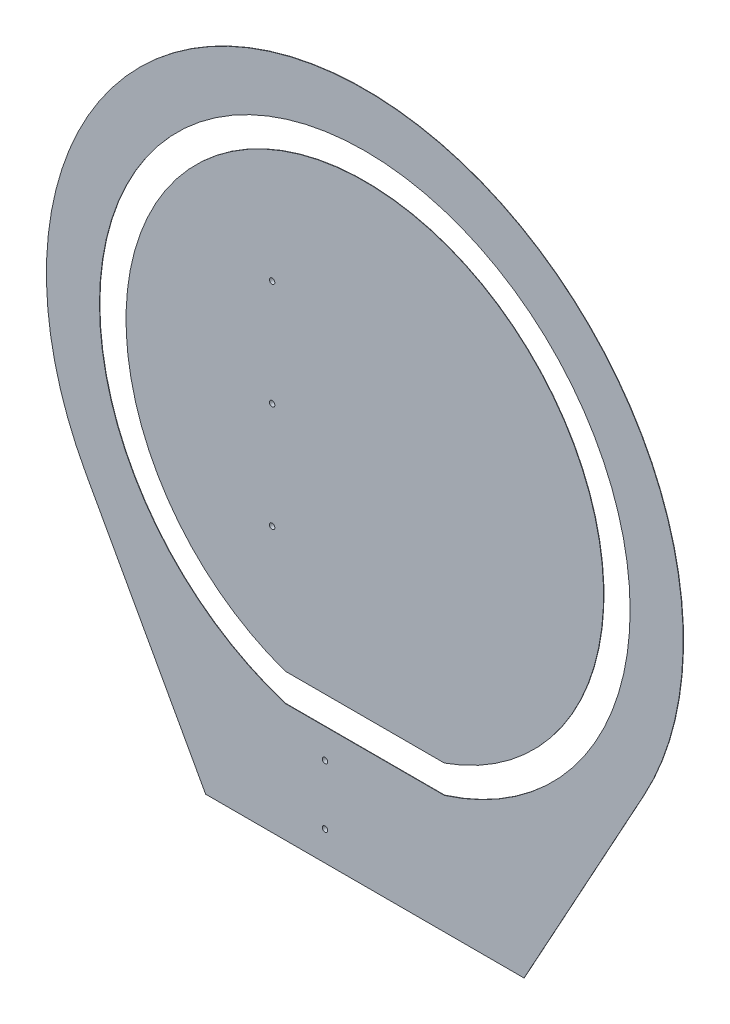
from build123d import *
from build123d.topology import SkipClean

# Parameters (mm, degrees)
BOSS_EXTRUDE1_DEPTH      = 0.03556
BOSS_EXTRUDE1_2_DEPTH    = 0.03556
SKETCH2_R                = 0.254
CUT_EXTRUDE1_DEPTH       = 10
ESBO_O1_R                = 0.27178
ESBO_O1_R_2              = 0.254
RESSALTO_EXTRUS_O1_DEPTH = 0.75438


with BuildPart() as part:
    # Sketch1 → Boss-Extrude1 (new body)
    with BuildSketch(Plane.XY):
        with BuildLine():
            Line((-7.500000004, -21.213203434), (7.500000004, -21.213203434))
            ThreePointArc((7.500000004, -21.213203434), (0, 22.5), (-7.500000004, -21.213203434))
        make_face()
    extrude(amount=BOSS_EXTRUDE1_DEPTH)


with BuildPart() as body_2:
    # Sketch1 → Boss-Extrude1 2 (new body)
    with BuildSketch(Plane.XY):
        with BuildLine():
            Line((-15, -35.000000034), (15, -35.000000034))
            Line((15, -35.000000034), (26.292884658, -14.445906561))
            ThreePointArc((26.292884658, -14.445906561), (0, 30), (-26.292884658, -14.445906561))
            Line((-26.292884658, -14.445906561), (-15, -35.000000034))
        make_face()
        with BuildLine():
            Line((-7.500000004, -23.848480034), (7.500000004, -23.848480034))
            ThreePointArc((7.500000004, -23.848480034), (0, 25), (-7.500000004, -23.848480034))
        make_face(mode=Mode.SUBTRACT)
    extrude(amount=BOSS_EXTRUDE1_2_DEPTH)


with BuildPart() as cut_extrude1_tool:
    # Sketch2 → Cut-Extrude1 (new body)
    with BuildSketch(Plane.XY.offset(0.03556)):
        with BuildLine():
            ThreePointArc((-3.496000002, -32.224240034), (-3.57039488, -32.044634912), (-3.750000002, -31.970240034))
            Line((-3.750000002, -31.970240034), (-3.750000002, -32.478240034))
            ThreePointArc((-3.750000002, -32.478240034), (-3.57039488, -32.403845156), (-3.496000002, -32.224240034))
        make_face()
        with BuildLine():
            Line((-3.750000002, -32.478240034), (-3.750000002, -31.970240034))
            ThreePointArc((-3.750000002, -31.970240034), (-4.004000002, -32.224240034), (-3.750000002, -32.478240034))
        make_face()
        with BuildLine():
            ThreePointArc((-3.496000002, -26.624240034), (-3.57039488, -26.444634912), (-3.750000002, -26.370240034))
            Line((-3.750000002, -26.370240034), (-3.750000002, -26.878240034))
            ThreePointArc((-3.750000002, -26.878240034), (-3.57039488, -26.803845156), (-3.496000002, -26.624240034))
        make_face()
        with BuildLine():
            Line((-3.750000002, -26.878240034), (-3.750000002, -26.370240034))
            ThreePointArc((-3.750000002, -26.370240034), (-4.004000002, -26.624240034), (-3.750000002, -26.878240034))
        make_face()
        with BuildLine():
            ThreePointArc((-8.479792148, -10), (-8.554187026, -9.820394878), (-8.733792148, -9.746))
            Line((-8.733792148, -9.746), (-8.733792148, -10.254))
            ThreePointArc((-8.733792148, -10.254), (-8.554187026, -10.179605122), (-8.479792148, -10))
        make_face()
        with BuildLine():
            Line((-8.733792148, -10.254), (-8.733792148, -9.746))
            ThreePointArc((-8.733792148, -9.746), (-8.987792148, -10), (-8.733792148, -10.254))
        make_face()
        with Locations((-8.733792148, 0)):
            Circle(SKETCH2_R)
        with Locations((-8.733792148, 10)):
            Circle(SKETCH2_R)
    extrude(amount=-CUT_EXTRUDE1_DEPTH)


with BuildPart() as part_1:
    add(part.part)

    # Cut-Extrude1: cut by cut_extrude1_tool
    add(cut_extrude1_tool.part, mode=Mode.SUBTRACT)



with BuildPart() as body_2_1:
    add(body_2.part)

    # Cut-Extrude1: cut by cut_extrude1_tool
    add(cut_extrude1_tool.part, mode=Mode.SUBTRACT)


with BuildPart() as part_2:
    with SkipClean():  # the faces are left unmerged after this step: merging them gives an invalid solid
        add(part_1.part)

        add(body_2_1.part)  # Ressalto-extrusão1 merges body 2
        # Esboço1 → Ressalto-extrusão1 (add)
        # profile 1 of 5: a face of its own
        with BuildSketch(Plane(origin=(0, 0, 0), x_dir=(-1, 0, 0), z_dir=(0, 0, -1))):
            with Locations(Location((8.733792148, 10, 0), (0, 0, 180))):
                Circle(ESBO_O1_R)
            with Locations(Location((8.733792148, 10, 0), (0, 0, 180))):
                Circle(ESBO_O1_R_2, mode=Mode.SUBTRACT)
        # profile 2 of 5: a face of its own
        with BuildSketch(Plane(origin=(0, 0, 0), x_dir=(-1, 0, 0), z_dir=(0, 0, -1))):
            with Locations(Location((8.733792148, 0, 0), (0, 0, 180))):
                Circle(ESBO_O1_R)
            with Locations(Location((8.733792148, 0, 0), (0, 0, 180))):
                Circle(ESBO_O1_R_2, mode=Mode.SUBTRACT)
        # profile 3 of 5: a face of its own
        with BuildSketch(Plane(origin=(0, 0, 0), x_dir=(-1, 0, 0), z_dir=(0, 0, -1))):
            with Locations(Location((8.733792148, -10, 0), (0, 0, 180))):
                Circle(ESBO_O1_R)
            with Locations(Location((8.733792148, -10, 0), (0, 0, 180))):
                Circle(ESBO_O1_R_2, mode=Mode.SUBTRACT)
        # profile 4 of 5: a face of its own
        with BuildSketch(Plane(origin=(0, 0, 0), x_dir=(-1, 0, 0), z_dir=(0, 0, -1))):
            with Locations(Location((3.750000002, -26.624240034, 0), (0, 0, 180))):
                Circle(ESBO_O1_R)
            with Locations(Location((3.750000002, -26.624240034, 0), (0, 0, 180))):
                Circle(ESBO_O1_R_2, mode=Mode.SUBTRACT)
        # profile 5 of 5: a face of its own
        with BuildSketch(Plane(origin=(0, 0, 0), x_dir=(-1, 0, 0), z_dir=(0, 0, -1))):
            with Locations(Location((3.750000002, -32.224240034, 0), (0, 0, 180))):
                Circle(ESBO_O1_R)
            with Locations(Location((3.750000002, -32.224240034, 0), (0, 0, 180))):
                Circle(ESBO_O1_R_2, mode=Mode.SUBTRACT)
        extrude(amount=RESSALTO_EXTRUS_O1_DEPTH)


solid = part_2.part
